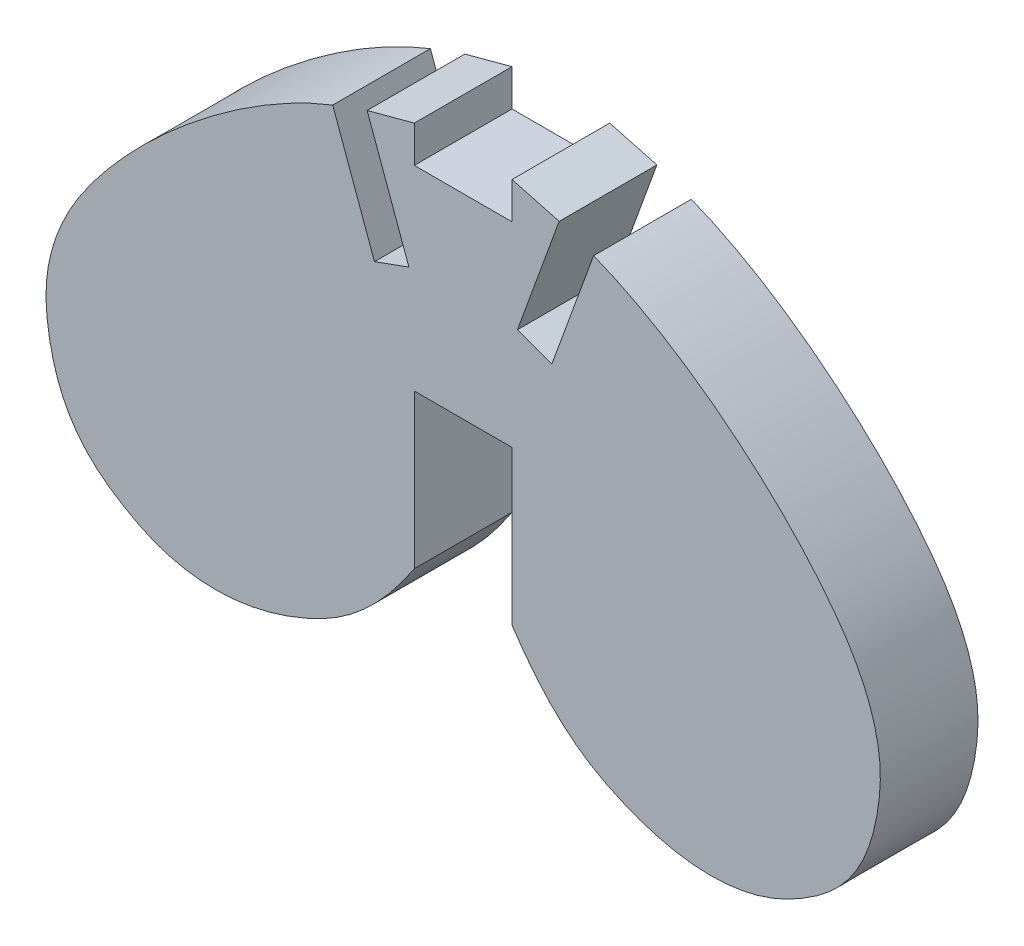
from build123d import *

# Parameters (mm, degrees)
ESTRUSIONE_ESTRUSIONE1_DEPTH = 4


with BuildPart() as part:
    # Schizzo1 → Estrusione-Estrusione1 (new body)
    with BuildSketch(Plane.XY):
        with BuildLine():
            Line((0, 0), (2, 0))
            Line((2, 0), (2, -6.302195892))
            add(Edge.make_bspline(
                [(4.310344835, -8), (3.483586589, -7.490001432), (2.73221103, -6.852638909), (2, -6.302195892)],
                knots=[0.856038395, 0.856038395, 0.856038395, 0.856038395, 1, 1, 1, 1], degree=3))
            Line((4.310344835, -8), (10.407199143, -8))
            add(Edge.make_bspline(
                [(12, -6.869045092), (11.513756787, -7.301207453), (10.970170801, -7.684535112), (10.407199143, -8)],
                knots=[0.501299358, 0.501299358, 0.501299358, 0.501299358, 0.571262605, 0.571262605, 0.571262605, 0.571262605], degree=3))
            Line((12, -6.869045092), (12, 2.311682347))
            Line((12, 2.311682347), (12, 3))
            Line((12, 3), (5.341390584, 8.469331695))
            Line((5.341390584, 8.469331695), (3.631289867, 3.770868591))
            Line((3.631289867, 3.770868591), (2.221750936, 4.283898806))
            Line((2.221750936, 4.283898806), (3.931851653, 8.98236191))
            Line((3.931851653, 8.98236191), (2, 9.5))
            Line((2, 9.5), (2, 8))
            Line((2, 8), (0, 8))
            Line((0, 8), (0, 0))
        make_face()
        with BuildLine():
            Line((-2, 0), (0, 0))
            Line((0, 0), (0, 8))
            Line((0, 8), (-2, 8))
            Line((-2, 8), (-2, 9.5))
            Line((-2, 9.5), (-3.931851653, 8.98236191))
            Line((-3.931851653, 8.98236191), (-2.221750936, 4.283898806))
            Line((-2.221750936, 4.283898806), (-3.631289867, 3.770868591))
            Line((-3.631289867, 3.770868591), (-5.341390584, 8.469331695))
            Line((-5.341390584, 8.469331695), (-12, 3))
            Line((-12, 3), (-12, 2.311682347))
            Line((-12, 2.311682347), (-12, -6.869045092))
            add(Edge.make_bspline(
                [(-12, -6.869045092), (-11.513756787, -7.301207453), (-10.970170801, -7.684535112), (-10.407199143, -8)],
                knots=[0.501299358, 0.501299358, 0.501299358, 0.501299358, 0.571262605, 0.571262605, 0.571262605, 0.571262605], degree=3))
            Line((-10.407199143, -8), (-4.310344835, -8))
            add(Edge.make_bspline(
                [(-4.310344835, -8), (-3.483586589, -7.490001432), (-2.73221103, -6.852638909), (-2, -6.302195892)],
                knots=[0.856038395, 0.856038395, 0.856038395, 0.856038395, 1, 1, 1, 1], degree=3))
            Line((-2, -6.302195892), (-2, 0))
        make_face()
        with BuildLine():
            add(Edge.make_bspline(
                [(4.310344835, -8), (3.483586589, -7.490001432), (2.73221103, -6.852638909), (2, -6.302195892)],
                knots=[0.856038395, 0.856038395, 0.856038395, 0.856038395, 1, 1, 1, 1], degree=3))
            add(Edge.make_bspline(
                [(3.295546107, -8), (2.874300166, -7.532046944), (2.442565159, -6.974124506), (2, -6.302195892)],
                knots=[0.949957537, 0.949957537, 0.949957537, 0.949957537, 1, 1, 1, 1], degree=3))
            Line((3.295546107, -8), (4.310344835, -8))
        make_face()
        with BuildLine():
            add(Edge.make_bspline(
                [(10.407199143, -8), (9.602799959, -8.450750399), (7.198555684, -9.340122668), (5.371686828, -8.654705169), (4.310344835, -8)],
                knots=[0.571262605, 0.571262605, 0.571262605, 0.571262605, 0.671229234, 0.856038395, 0.856038395, 0.856038395, 0.856038395], degree=3))
            Line((4.310344835, -8), (3.295546107, -8))
            add(Edge.make_bspline(
                [(5.341390584, 8.469331695), (8.537151194, 7.222339938), (12.883997634, 3.92565225), (16.486733399, -0.954862824), (17.214438113, -3.291976941), (16.770315281, -7.608016106), (15.23784076, -9.351475115), (11.436068595, -11.372222281), (8.758429673, -11.153774105), (5.986187551, -10.138037533), (4.50180035, -9.340001894), (3.295546107, -8)],
                knots=[0, 0, 0, 0, 0.18231078, 0.212904018, 0.295595895, 0.328759179, 0.511373572, 0.559297999, 0.760079022, 0.806658985, 0.949957537, 0.949957537, 0.949957537, 0.949957537], degree=3))
            Line((5.341390584, 8.469331695), (12, 3))
            Line((12, 3), (12, 2.311682347))
            add(Edge.make_bspline(
                [(12, 2.311682347), (14.007467918, -0.285839726), (14.842785118, -3.659074254), (12.618684042, -6.319172212), (12, -6.869045092)],
                knots=[0.124787775, 0.124787775, 0.124787775, 0.124787775, 0.412279823, 0.501299358, 0.501299358, 0.501299358, 0.501299358], degree=3))
            Line((12, -6.869045092), (12, -8))
            Line((12, -8), (10.407199143, -8))
        make_face()
        with BuildLine():
            Line((10.407199143, -8), (4.310344835, -8))
            add(Edge.make_bspline(
                [(10.407199143, -8), (9.602799959, -8.450750399), (7.198555684, -9.340122668), (5.371686828, -8.654705169), (4.310344835, -8)],
                knots=[0.571262605, 0.571262605, 0.571262605, 0.571262605, 0.671229234, 0.856038395, 0.856038395, 0.856038395, 0.856038395], degree=3))
        make_face()
        with BuildLine():
            add(Edge.make_bspline(
                [(-3.295546107, -8), (-2.874300166, -7.532046944), (-2.442565159, -6.974124506), (-2, -6.302195892)],
                knots=[0.949957537, 0.949957537, 0.949957537, 0.949957537, 1, 1, 1, 1], degree=3))
            add(Edge.make_bspline(
                [(-4.310344835, -8), (-3.483586589, -7.490001432), (-2.73221103, -6.852638909), (-2, -6.302195892)],
                knots=[0.856038395, 0.856038395, 0.856038395, 0.856038395, 1, 1, 1, 1], degree=3))
            Line((-4.310344835, -8), (-3.295546107, -8))
        make_face()
        with BuildLine():
            add(Edge.make_bspline(
                [(12, -6.869045092), (11.513756787, -7.301207453), (10.970170801, -7.684535112), (10.407199143, -8)],
                knots=[0.501299358, 0.501299358, 0.501299358, 0.501299358, 0.571262605, 0.571262605, 0.571262605, 0.571262605], degree=3))
            Line((10.407199143, -8), (12, -8))
            Line((12, -8), (12, -6.869045092))
        make_face()
        with BuildLine():
            add(Edge.make_bspline(
                [(-5.341390584, 8.469331695), (-8.537151194, 7.222339938), (-12.883997634, 3.92565225), (-16.486733399, -0.954862824), (-17.214438113, -3.291976941), (-16.770315281, -7.608016106), (-15.23784076, -9.351475115), (-11.436068595, -11.372222281), (-8.758429673, -11.153774105), (-5.986187551, -10.138037533), (-4.50180035, -9.340001894), (-3.295546107, -8)],
                knots=[0, 0, 0, 0, 0.18231078, 0.212904018, 0.295595895, 0.328759179, 0.511373572, 0.559297999, 0.760079022, 0.806658985, 0.949957537, 0.949957537, 0.949957537, 0.949957537], degree=3))
            Line((-3.295546107, -8), (-4.310344835, -8))
            add(Edge.make_bspline(
                [(-10.407199143, -8), (-9.602799959, -8.450750399), (-7.198555684, -9.340122668), (-5.371686828, -8.654705169), (-4.310344835, -8)],
                knots=[0.571262605, 0.571262605, 0.571262605, 0.571262605, 0.671229234, 0.856038395, 0.856038395, 0.856038395, 0.856038395], degree=3))
            Line((-10.407199143, -8), (-12, -8))
            Line((-12, -8), (-12, -6.869045092))
            add(Edge.make_bspline(
                [(-12, 2.311682347), (-14.007467918, -0.285839726), (-14.842785118, -3.659074254), (-12.618684042, -6.319172212), (-12, -6.869045092)],
                knots=[0.124787775, 0.124787775, 0.124787775, 0.124787775, 0.412279823, 0.501299358, 0.501299358, 0.501299358, 0.501299358], degree=3))
            Line((-12, 2.311682347), (-12, 3))
            Line((-12, 3), (-5.341390584, 8.469331695))
        make_face()
        with BuildLine():
            add(Edge.make_bspline(
                [(-10.407199143, -8), (-9.602799959, -8.450750399), (-7.198555684, -9.340122668), (-5.371686828, -8.654705169), (-4.310344835, -8)],
                knots=[0.571262605, 0.571262605, 0.571262605, 0.571262605, 0.671229234, 0.856038395, 0.856038395, 0.856038395, 0.856038395], degree=3))
            Line((-4.310344835, -8), (-10.407199143, -8))
        make_face()
        with BuildLine():
            Line((12, 2.311682347), (12, -6.869045092))
            add(Edge.make_bspline(
                [(12, 2.311682347), (14.007467918, -0.285839726), (14.842785118, -3.659074254), (12.618684042, -6.319172212), (12, -6.869045092)],
                knots=[0.124787775, 0.124787775, 0.124787775, 0.124787775, 0.412279823, 0.501299358, 0.501299358, 0.501299358, 0.501299358], degree=3))
        make_face()
        with BuildLine():
            Line((-12, -8), (-10.407199143, -8))
            add(Edge.make_bspline(
                [(-12, -6.869045092), (-11.513756787, -7.301207453), (-10.970170801, -7.684535112), (-10.407199143, -8)],
                knots=[0.501299358, 0.501299358, 0.501299358, 0.501299358, 0.571262605, 0.571262605, 0.571262605, 0.571262605], degree=3))
            Line((-12, -6.869045092), (-12, -8))
        make_face()
        with BuildLine():
            add(Edge.make_bspline(
                [(-12, 2.311682347), (-14.007467918, -0.285839726), (-14.842785118, -3.659074254), (-12.618684042, -6.319172212), (-12, -6.869045092)],
                knots=[0.124787775, 0.124787775, 0.124787775, 0.124787775, 0.412279823, 0.501299358, 0.501299358, 0.501299358, 0.501299358], degree=3))
            Line((-12, -6.869045092), (-12, 2.311682347))
        make_face()
    extrude(amount=ESTRUSIONE_ESTRUSIONE1_DEPTH)


solid = part.part
